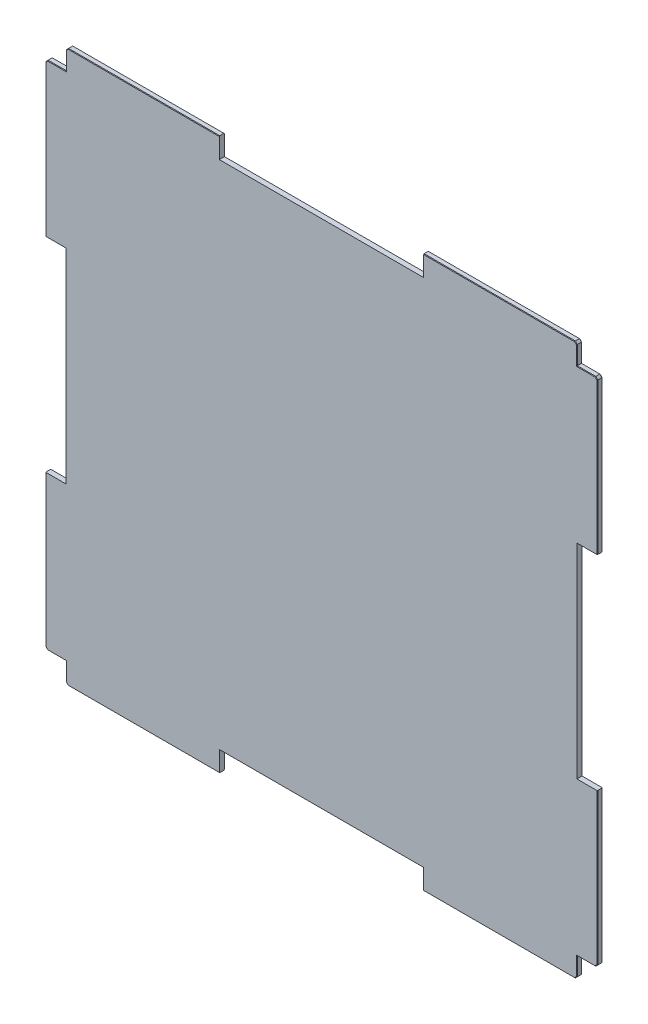
from build123d import *

# Parameters (mm, degrees)
SKETCH1_W           = 540
SKETCH1_H           = 540
BOSS_EXTRUDE1_DEPTH = 5
SKETCH2_W           = 20
SKETCH2_H           = 20
CUT_EXTRUDE1_DEPTH  = 5
CHAMFER1_SIZE       = 2
CHAMFER2_SIZE       = 0.5
SKETCH3_W           = 200
SKETCH3_H           = 77.416612185
CUT_EXTRUDE2_DEPTH  = 10
CIRPATTERN1_COUNT   = 4


with BuildPart() as part:
    # Sketch1 → Boss-Extrude1 (new body)
    with BuildSketch(Plane.XY):
        with Locations((270, 270)):
            Rectangle(SKETCH1_W, SKETCH1_H)
    extrude(amount=BOSS_EXTRUDE1_DEPTH)

    # Sketch2 → Cut-Extrude1 (cut)
    with BuildSketch(Plane.XY.offset(5)):
        with Locations((10, 530)):
            Rectangle(SKETCH2_W, SKETCH2_H)
        with Locations((530, 530)):
            Rectangle(SKETCH2_W, SKETCH2_H)
        with Locations((530, 10)):
            Rectangle(SKETCH2_W, SKETCH2_H)
        with Locations((10, 10)):
            Rectangle(SKETCH2_W, SKETCH2_H)
    extrude(amount=-CUT_EXTRUDE1_DEPTH, mode=Mode.SUBTRACT)

    # Chamfer1
    chamfer1_edges = [part.edges().sort_by_distance(p)[0] for p in [
        (0, 520, 2.5),
        (20, 540, 2.5),
        (520, 540, 2.5),
        (540, 520, 2.5),
        (20, 0, 2.5),
        (0, 20, 2.5),
        (540, 20, 2.5),
        (520, 0, 2.5),
    ]]
    chamfer(chamfer1_edges, length=CHAMFER1_SIZE)

    # Chamfer2
    chamfer2_edges = [part.edges().sort_by_distance(p)[0] for p in [
        (1, 21, 0),
        (11, 20, 0),
        (20, 11, 0),
        (21, 1, 0),
        (270, 0, 0),
        (519, 1, 0),
        (520, 11, 0),
        (529, 20, 0),
        (539, 21, 0),
        (540, 270, 0),
        (539, 519, 0),
        (529, 520, 0),
        (520, 529, 0),
        (519, 539, 0),
        (270, 540, 0),
        (21, 539, 0),
        (20, 529, 0),
        (11, 520, 0),
        (1, 519, 0),
        (0, 270, 0),
        (20, 529, 5),
        (21, 539, 5),
        (270, 540, 5),
        (519, 539, 5),
        (520, 529, 5),
        (529, 520, 5),
        (539, 519, 5),
        (540, 270, 5),
        (539, 21, 5),
        (529, 20, 5),
        (520, 11, 5),
        (519, 1, 5),
        (270, 0, 5),
        (21, 1, 5),
        (20, 11, 5),
        (11, 20, 5),
        (1, 21, 5),
        (0, 270, 5),
        (1, 519, 5),
        (11, 520, 5),
    ]]
    chamfer(chamfer2_edges, length=CHAMFER2_SIZE)

    # Sketch3 → Cut-Extrude2 (cut)
    with BuildSketch(Plane.XY.offset(5)):
        with Locations((270, 558.708306093)):
            Rectangle(SKETCH3_W, SKETCH3_H)
    cut_extrude2 = extrude(amount=-CUT_EXTRUDE2_DEPTH, mode=Mode.SUBTRACT)

    # CirPattern1: Cut-Extrude2 ×4 about axis
    cirpattern1_axis = Axis((270, 270, 5), (0, 0, 1))
    for i in range(1, CIRPATTERN1_COUNT):
        add(cut_extrude2.rotate(cirpattern1_axis, i * 360 / CIRPATTERN1_COUNT), mode=Mode.SUBTRACT)


solid = part.part
